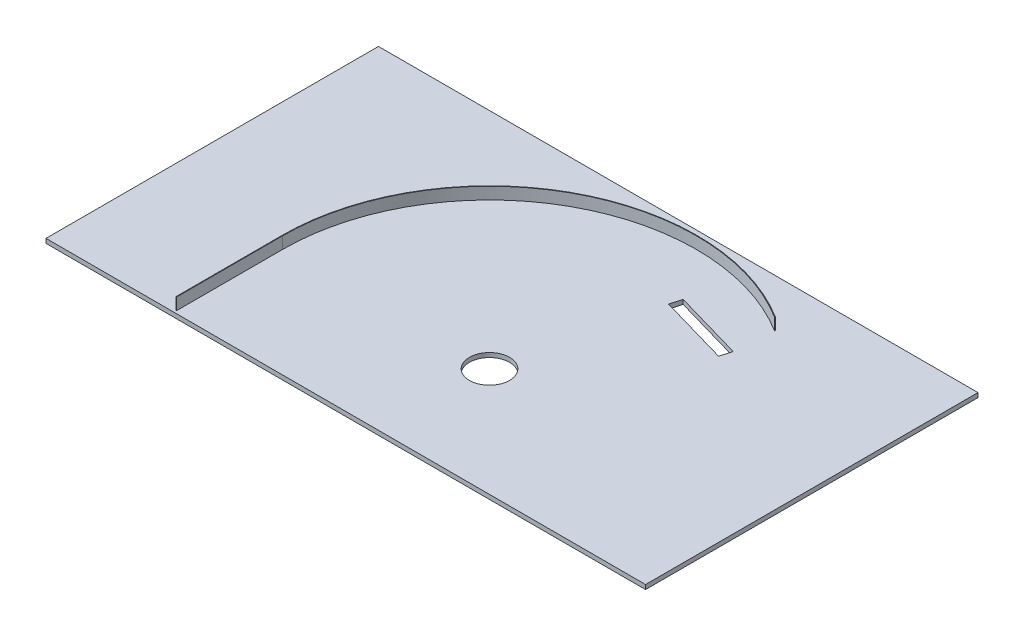
from build123d import *

# Parameters (mm, degrees)
BOSS_EXTRUDE1_DEPTH    = 30
SKETCH4_W              = 1518.677694458
SKETCH4_H              = 842.1
BOSS_EXTRUDE2_DEPTH    = 11.1125
F_20_0MM_DOWEL_HOLE1_D = 101.6
SKETCH8_W              = 1.5875
SKETCH8_H              = 30
BOSS_EXTRUDE3_DEPTH    = 269.05
CUT_EXTRUDE1_DEPTH     = 1021.368996981


with BuildPart() as part:
    # Sketch3 → Boss-Extrude1 (new body)
    with BuildSketch(Plane(origin=(0, 0, 0), x_dir=(1, 0, 0), z_dir=(0, 1, 0))):
        with BuildLine():
            Line((-524, 0), (-525.5875, 0))
            ThreePointArc((-525.5875, 0), (-255.243310314, 459.448661655), (277.677694458, 446.248045549))
            Line((277.677694458, 446.248045549), (277.677694458, 444.377202386))
            ThreePointArc((277.677694458, 444.377202386), (-254.040241009, 458.300726541), (-524, 0))
        make_face()
    extrude(amount=BOSS_EXTRUDE1_DEPTH)

    # Sketch4 → Boss-Extrude2 (add)
    with BuildSketch(Plane(origin=(0, 0, 0), x_dir=(1, 0, 0), z_dir=(0, 1, 0))):
        with Locations((-88.661152771, 145.65)):
            Rectangle(SKETCH4_W, SKETCH4_H)
    extrude(amount=-BOSS_EXTRUDE2_DEPTH)

    # Ø20.0mm Dowel Hole1 (through all)
    with Locations(Plane(origin=(0, 0, 0), x_dir=(1, 0, 0), z_dir=(0, 1, 0))):
        with Locations((0, 0)):
            Hole(F_20_0MM_DOWEL_HOLE1_D / 2)

    # Sketch8 → Boss-Extrude3 (add)
    with BuildSketch(Plane.XY):
        with Locations((-524.79375, 15)):
            Rectangle(SKETCH8_W, SKETCH8_H)
    extrude(amount=BOSS_EXTRUDE3_DEPTH)

    # Sketch9 → Cut-Extrude1 (cut, through all)
    with BuildSketch(Plane(origin=(0, 0, 0), x_dir=(1, 0, 0), z_dir=(0, 1, 0))):
        Polygon((270.669120675, 346.737850878), (92.835706926, 397.730761704), (84.566586251, 368.892910826), (262.4, 317.9), align=None)
    extrude(amount=-CUT_EXTRUDE1_DEPTH, mode=Mode.SUBTRACT)


solid = part.part
